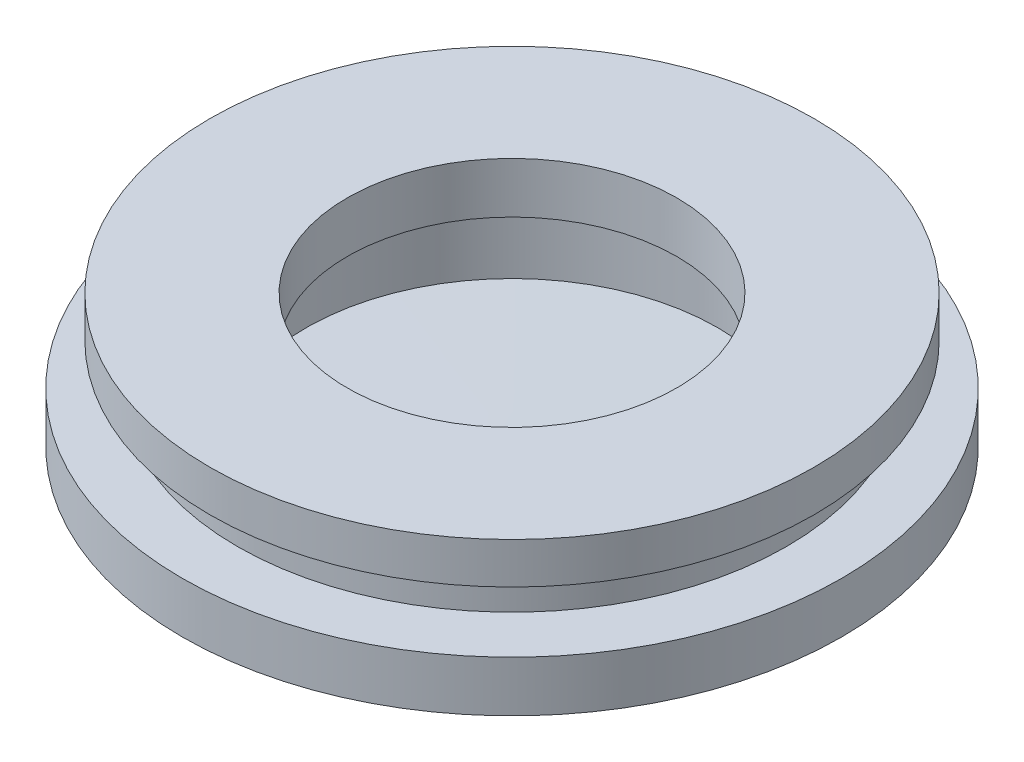
from build123d import *


with BuildPart() as part:
    # Sketch2 → Revolve1 (revolve)
    with BuildSketch(Plane.XY, mode=Mode.PRIVATE) as revolve1_sk:
        Polygon((0, 0), (0, 9.220121932), (-11, 9.220121932), (-11, 7.720121932), (-10, 7.720121932), (-10, 6.220121932), (-12.006811328, 6.220121932), (-12.006811328, 4.370121932), align=None)
    revolve(revolve1_sk.sketch.rotate(Axis((0, 0, 0), (0, 1, 0)), 270), axis=Axis((0, 0, 0), (0, 1, 0)))

    # Sketch3 → Cut-Revolve1 (revolve, cut)
    with BuildSketch(Plane.XY, mode=Mode.PRIVATE) as cut_revolve1_sk:
        Polygon((0, 4.441105813), (0, 10.370121932), (-6, 10.370121932), (-6, 7.370121932), (-7.5, 7.370121932), (-7.5, 4.370121932), align=None)
    revolve(cut_revolve1_sk.sketch.rotate(Axis((0, 4.441105813, 0), (0, 1, 0)), 270), axis=Axis((0, 4.441105813, 0), (0, 1, 0)), mode=Mode.SUBTRACT)


solid = part.part
